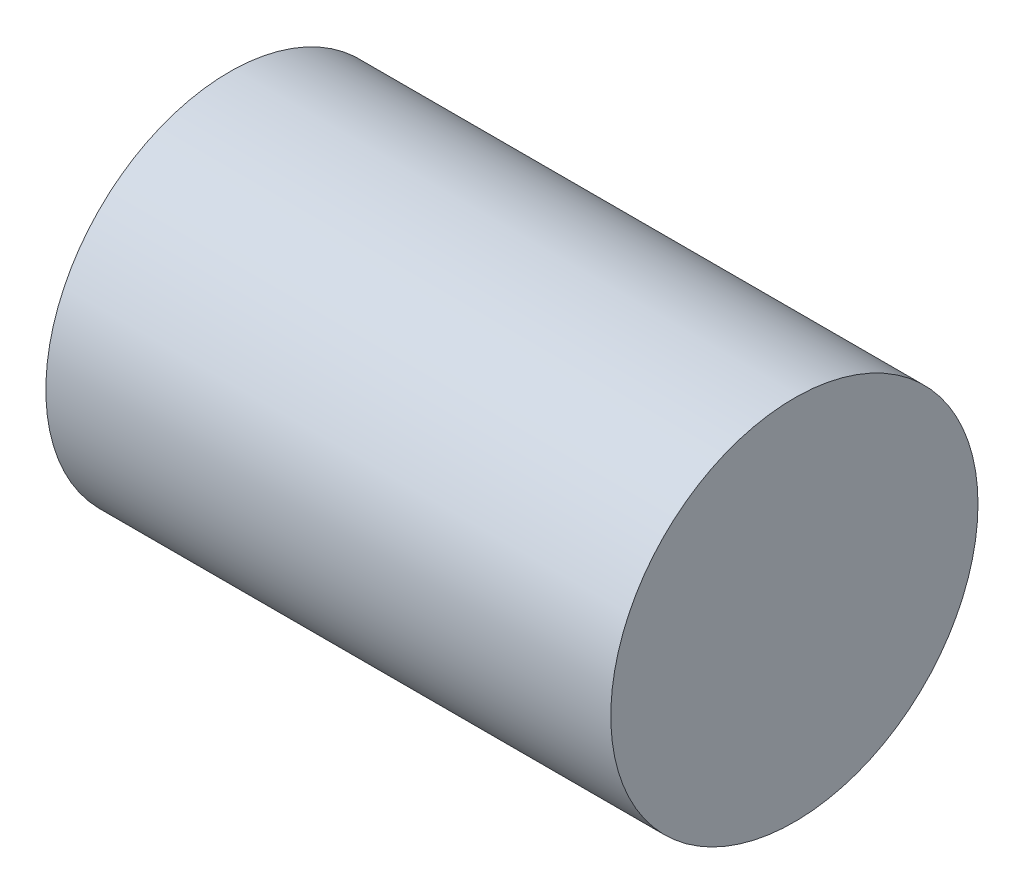
from build123d import *

# Parameters (mm, degrees)
SKETCH1_R           = 26
BOSS_EXTRUDE1_DEPTH = 80


with BuildPart() as part:
    # Sketch1 → Boss-Extrude1 (new body)
    with BuildSketch(Plane(origin=(0, 0, 0), x_dir=(0, 0, -1), z_dir=(1, 0, 0))):
        Circle(SKETCH1_R)
    extrude(amount=BOSS_EXTRUDE1_DEPTH)


solid = part.part
